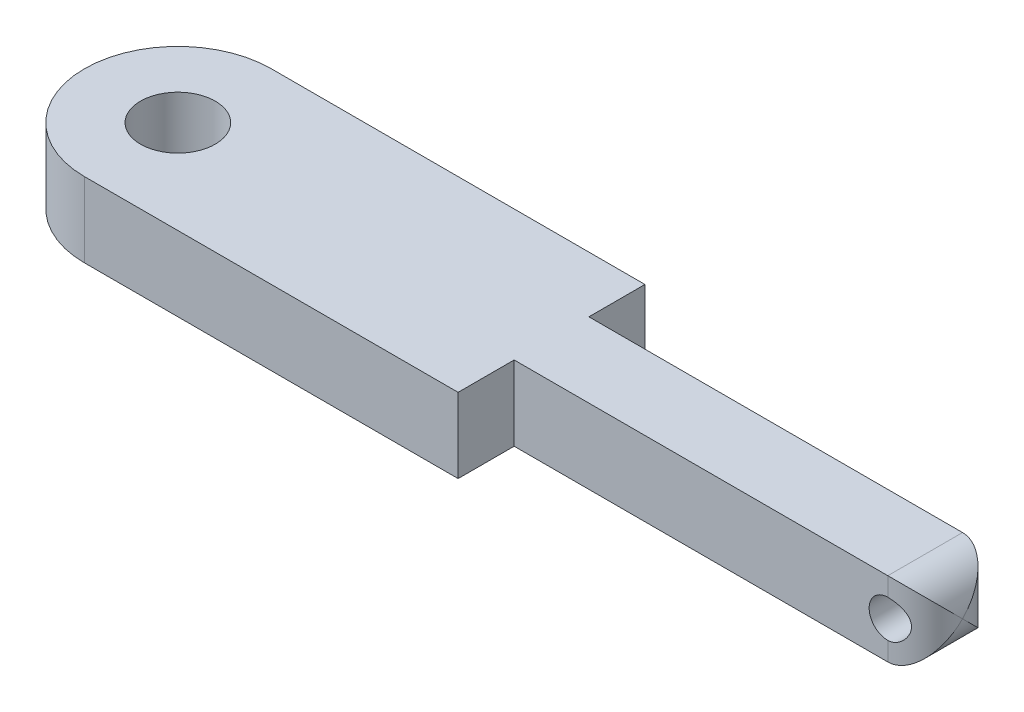
from build123d import *

# Parameters (mm, degrees)
SKETCH1_R               = 1
BOSS_EXTRUDE1_DEPTH     = 2
SKETCH4_W               = 2
SKETCH4_H               = 2
BOSS_EXTRUDE2_DEPTH     = 11
CUT_EXTRUDE1_DEPTH      = 13.903487901
CUT_EXTRUDE1_DEPTH_BACK = 13.903487901
CUT_EXTRUDE2_DEPTH      = 14.133925537
CUT_EXTRUDE2_DEPTH_BACK = 14.133925537
CUT_EXTRUDE3_DEPTH      = 14.133925537
CUT_EXTRUDE3_DEPTH_BACK = 14.133925537
SKETCH7_R               = 0.5


with BuildPart() as part:
    # Sketch1 → Boss-Extrude1 (new body)
    with BuildSketch(Plane(origin=(0, 0, 0), x_dir=(1, 0, 0), z_dir=(0, 1, 0))):
        with BuildLine():
            Line((-10, 2.5), (0, 2.5))
            Line((0, 2.5), (0, -2.5))
            Line((0, -2.5), (-10, -2.5))
            ThreePointArc((-10, -2.5), (-12.5, 0), (-10, 2.5))
        make_face()
        with Locations(Location((-10, 0, 0), (0, 0, 270))):
            Circle(SKETCH1_R, mode=Mode.SUBTRACT)
    extrude(amount=BOSS_EXTRUDE1_DEPTH)

    # Sketch4 → Boss-Extrude2 (add)
    with BuildSketch(Plane(origin=(0, 0, 0), x_dir=(0, 0, -1), z_dir=(1, 0, 0))):
        with Locations((0, 1)):
            Rectangle(SKETCH4_W, SKETCH4_H)
    extrude(amount=BOSS_EXTRUDE2_DEPTH)

    # Sketch5 → Cut-Extrude1 (cut, two sides: drawn at the far end of the back side and taken through both)
    with BuildSketch(Plane(origin=(0, 2, 0), x_dir=(1, 0, 0), z_dir=(0, 1, 0)).offset(-CUT_EXTRUDE1_DEPTH_BACK)):
        with BuildLine():
            Line((10, 1), (10, 1.5))
            Line((10, 1.5), (12, 1.5))
            Line((12, 1.5), (12, -1.5))
            Line((12, -1.5), (10, -1.5))
            Line((10, -1.5), (10, -1))
            ThreePointArc((10, -1), (11, 0), (10, 1))
        make_face()
    extrude(amount=CUT_EXTRUDE1_DEPTH + CUT_EXTRUDE1_DEPTH_BACK, mode=Mode.SUBTRACT)

    # Sketch6 → Cut-Extrude2 (cut, two sides: drawn at the far end of the back side and taken through both)
    with BuildSketch(Plane(origin=(0, 0, -1), x_dir=(-1, 0, 0), z_dir=(0, 0, -1)).offset(-CUT_EXTRUDE2_DEPTH_BACK)):
        with BuildLine():
            Line((-10, 2), (-10, 2.5))
            Line((-10, 2.5), (-12, 2.5))
            Line((-12, 2.5), (-12, -0.5))
            Line((-12, -0.5), (-10, -0.5))
            Line((-10, -0.5), (-10, 0))
            ThreePointArc((-10, 0), (-11, 1), (-10, 2))
        make_face()
    extrude(amount=CUT_EXTRUDE2_DEPTH + CUT_EXTRUDE2_DEPTH_BACK, mode=Mode.SUBTRACT)

    # Sketch7 → Cut-Extrude3 (cut, two sides: drawn at the far end of the back side and taken through both)
    with BuildSketch(Plane(origin=(0, 0, -1), x_dir=(-1, 0, 0), z_dir=(0, 0, -1)).offset(-CUT_EXTRUDE3_DEPTH_BACK)):
        with Locations(Location((-10, 1, 0), (0, 0, 90))):
            Circle(SKETCH7_R)
    extrude(amount=CUT_EXTRUDE3_DEPTH + CUT_EXTRUDE3_DEPTH_BACK, mode=Mode.SUBTRACT)


solid = part.part
